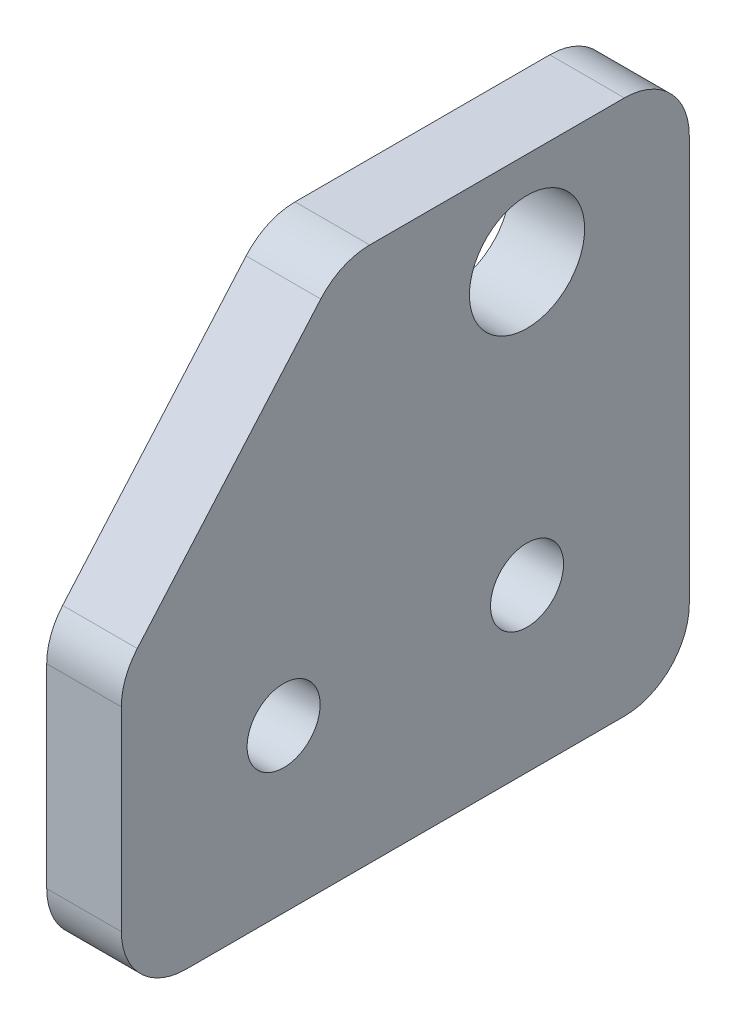
from build123d import *

# Parameters (mm, degrees)
SKETCH1_R           = 2.25
SKETCH1_R_2         = 3.55
BOSS_EXTRUDE1_DEPTH = 4.6


with BuildPart() as part:
    # Sketch1 → Boss-Extrude1 (new body)
    with BuildSketch(Plane(origin=(0, 0, 0), x_dir=(0, 0, -1), z_dir=(1, 0, 0))):
        with BuildLine():
            Line((-21, -10), (6, -10))
            ThreePointArc((6, -10), (8.828427125, -8.828427125), (10, -6))
            Line((10, -6), (10, 19))
            ThreePointArc((10, 19), (8.828427125, 21.828427125), (6, 23))
            Line((6, 23), (-9.695652174, 23))
            ThreePointArc((-9.695652174, 23), (-11.354136506, 22.63997661), (-12.714074263, 21.62471486))
            Line((-12.714074263, 21.62471486), (-24.018422089, 8.62471486))
            ThreePointArc((-24.018422089, 8.62471486), (-24.746577662, 7.401126626), (-25, 6))
            Line((-25, 6), (-25, -6))
            ThreePointArc((-25, -6), (-23.828427125, -8.828427125), (-21, -10))
        make_face()
        with Locations((-15, 0)):
            Circle(SKETCH1_R, mode=Mode.SUBTRACT)
        with Locations((0, 17.25)):
            Circle(SKETCH1_R_2, mode=Mode.SUBTRACT)
        Circle(SKETCH1_R, mode=Mode.SUBTRACT)
    extrude(amount=BOSS_EXTRUDE1_DEPTH)


solid = part.part
